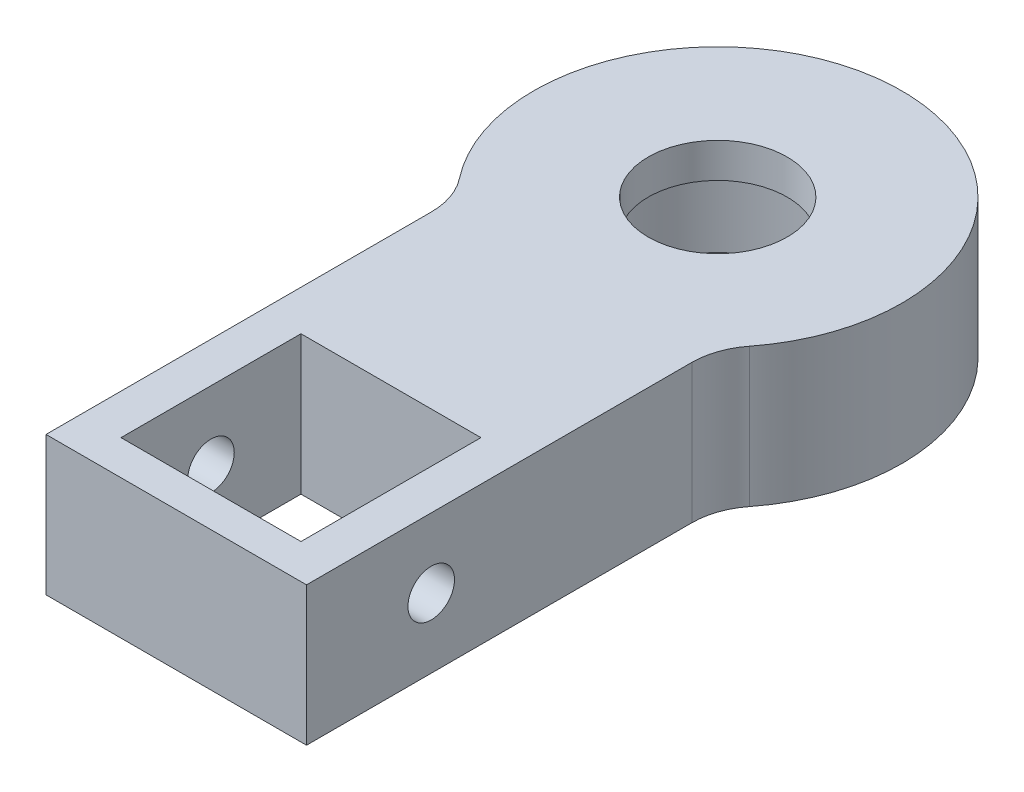
from build123d import *

# Parameters (mm, degrees)
SKETCH1_R           = 18.5
SKETCH1_W           = 25.908
SKETCH1_H           = 25.908
BOSS_EXTRUDE1_DEPTH = 10
SKETCH2_R           = 26.5
SKETCH2_R_2         = 10
BOSS_EXTRUDE2_DEPTH = 5
SKETCH3_W           = 42.310591005
SKETCH3_H           = 3.35
FILLET1_R           = 10


with BuildPart() as part:
    # Sketch1 → Boss-Extrude1 (new, symmetric)
    with BuildSketch(Plane(origin=(0, 0, 0), x_dir=(1, 0, 0), z_dir=(0, 1, 0))):
        with BuildLine():
            Line((-18.754, -77.954), (18.754, -77.954))
            Line((18.754, -77.954), (18.754, -18.722646287))
            ThreePointArc((18.754, -18.722646287), (0, 26.5), (-18.754, -18.722646287))
            Line((-18.754, -18.722646287), (-18.754, -77.954))
        make_face()
        with Locations(Location((0, 0, 0), (0, 0, 270))):
            Circle(SKETCH1_R, mode=Mode.SUBTRACT)
        with Locations((0, -60)):
            Rectangle(SKETCH1_W, SKETCH1_H, mode=Mode.SUBTRACT)
    extrude(amount=BOSS_EXTRUDE1_DEPTH, both=True)

    # Sketch2 → Boss-Extrude2 (add)
    with BuildSketch(Plane(origin=(0, 10, 0), x_dir=(1, 0, 0), z_dir=(0, 1, 0))):
        Circle(SKETCH2_R)
        with Locations(Location((0, 0, 0), (0, 0, 270))):
            Circle(SKETCH2_R_2, mode=Mode.SUBTRACT)
    extrude(amount=-BOSS_EXTRUDE2_DEPTH)

    # Sketch3 → Cut-Revolve1 (revolve, cut)
    with BuildSketch(Plane(origin=(0, 0, 0), x_dir=(1, 0, 0), z_dir=(0, 1, 0))):
        with Locations((0.530790347, -58.325)):
            Rectangle(SKETCH3_W, SKETCH3_H)
    revolve(axis=Axis((-24.494150326, 0, 60), (1, 0, 0)), mode=Mode.SUBTRACT)

    # Fillet1
    fillet1_edges = [part.edges().sort_by_distance(p)[0] for p in [
        (18.754, 0, 18.722646287),
        (-18.754, 0, 18.722646287),
    ]]
    fillet(fillet1_edges, radius=FILLET1_R)


solid = part.part
